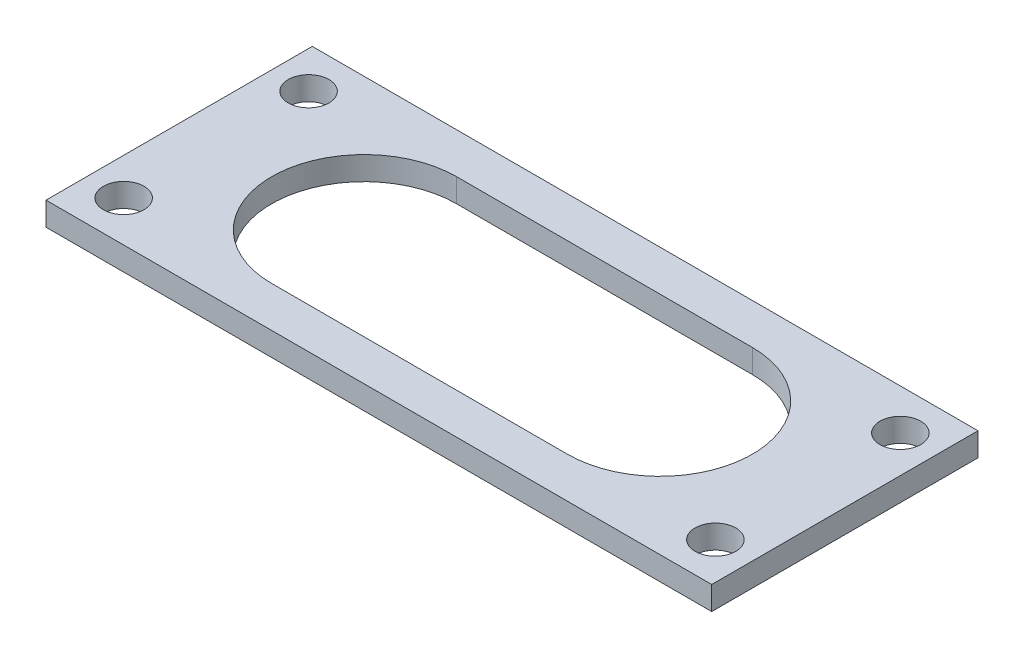
from build123d import *

# Parameters (mm, degrees)
SKETCH1_W           = 90
SKETCH1_H           = 36
BOSS_EXTRUDE1_DEPTH = 3.175
CUT_EXTRUDE1_REACH  = 50.57
SKETCH2_R           = 2.75
CUT_EXTRUDE2_REACH  = 50.57


with BuildPart() as part:
    # Sketch1 → Boss-Extrude1 (new body)
    with BuildSketch(Plane(origin=(0, 0, 0), x_dir=(1, 0, 0), z_dir=(0, 1, 0))):
        Rectangle(SKETCH1_W, SKETCH1_H)
    extrude(amount=BOSS_EXTRUDE1_DEPTH)

    # Sketch2 → Cut-Extrude1 (cut, up to next)
    with BuildSketch(Plane(origin=(0, 3.175, 0), x_dir=(1, 0, 0), z_dir=(0, 1, 0)), mode=Mode.PRIVATE) as cut_extrude1_sk1:
        with Locations(Location((40, 12.5, 0), (0, 0, 270))):
            Circle(SKETCH2_R)
    cut_extrude1_tool1 = extrude(cut_extrude1_sk1.sketch, amount=-CUT_EXTRUDE1_REACH, mode=Mode.PRIVATE) & part.part
    # Sketch2 → Cut-Extrude1 (cut, up to next)
    with BuildSketch(Plane(origin=(0, 3.175, 0), x_dir=(1, 0, 0), z_dir=(0, 1, 0)), mode=Mode.PRIVATE) as cut_extrude1_sk2:
        with Locations(Location((-40, 12.5, 0), (0, 0, 270))):
            Circle(SKETCH2_R)
    cut_extrude1_tool2 = extrude(cut_extrude1_sk2.sketch, amount=-CUT_EXTRUDE1_REACH, mode=Mode.PRIVATE) & part.part
    # Sketch2 → Cut-Extrude1 (cut, up to next)
    with BuildSketch(Plane(origin=(0, 3.175, 0), x_dir=(1, 0, 0), z_dir=(0, 1, 0)), mode=Mode.PRIVATE) as cut_extrude1_sk3:
        with Locations(Location((-40, -12.5, 0), (0, 0, 270))):
            Circle(SKETCH2_R)
    cut_extrude1_tool3 = extrude(cut_extrude1_sk3.sketch, amount=-CUT_EXTRUDE1_REACH, mode=Mode.PRIVATE) & part.part
    # Sketch2 → Cut-Extrude1 (cut, up to next)
    with BuildSketch(Plane(origin=(0, 3.175, 0), x_dir=(1, 0, 0), z_dir=(0, 1, 0)), mode=Mode.PRIVATE) as cut_extrude1_sk4:
        with Locations(Location((40, -12.5, 0), (0, 0, 270))):
            Circle(SKETCH2_R)
    cut_extrude1_tool4 = extrude(cut_extrude1_sk4.sketch, amount=-CUT_EXTRUDE1_REACH, mode=Mode.PRIVATE) & part.part
    add(cut_extrude1_tool1.solids().sort_by_distance((40, 3.175, -12.5))[0], mode=Mode.SUBTRACT)
    add(cut_extrude1_tool2.solids().sort_by_distance((-40, 3.175, -12.5))[0], mode=Mode.SUBTRACT)
    add(cut_extrude1_tool3.solids().sort_by_distance((-40, 3.175, 12.5))[0], mode=Mode.SUBTRACT)
    add(cut_extrude1_tool4.solids().sort_by_distance((40, 3.175, 12.5))[0], mode=Mode.SUBTRACT)

    # Sketch3 → Cut-Extrude2 (cut, up to next)
    with BuildSketch(Plane(origin=(0, 3.175, 0), x_dir=(1, 0, 0), z_dir=(0, 1, 0)), mode=Mode.PRIVATE) as cut_extrude2_sk1:
        with BuildLine():
            Line((20, -12.5), (-20, -12.5))
            ThreePointArc((-20, -12.5), (-32.5, 0), (-20, 12.5))
            Line((-20, 12.5), (20, 12.5))
            ThreePointArc((20, 12.5), (32.5, 0), (20, -12.5))
        make_face()
    cut_extrude2_tool1 = extrude(cut_extrude2_sk1.sketch, amount=-CUT_EXTRUDE2_REACH, mode=Mode.PRIVATE) & part.part
    add(cut_extrude2_tool1.solids().sort_by_distance((0, 3.175, 0))[0], mode=Mode.SUBTRACT)


solid = part.part
